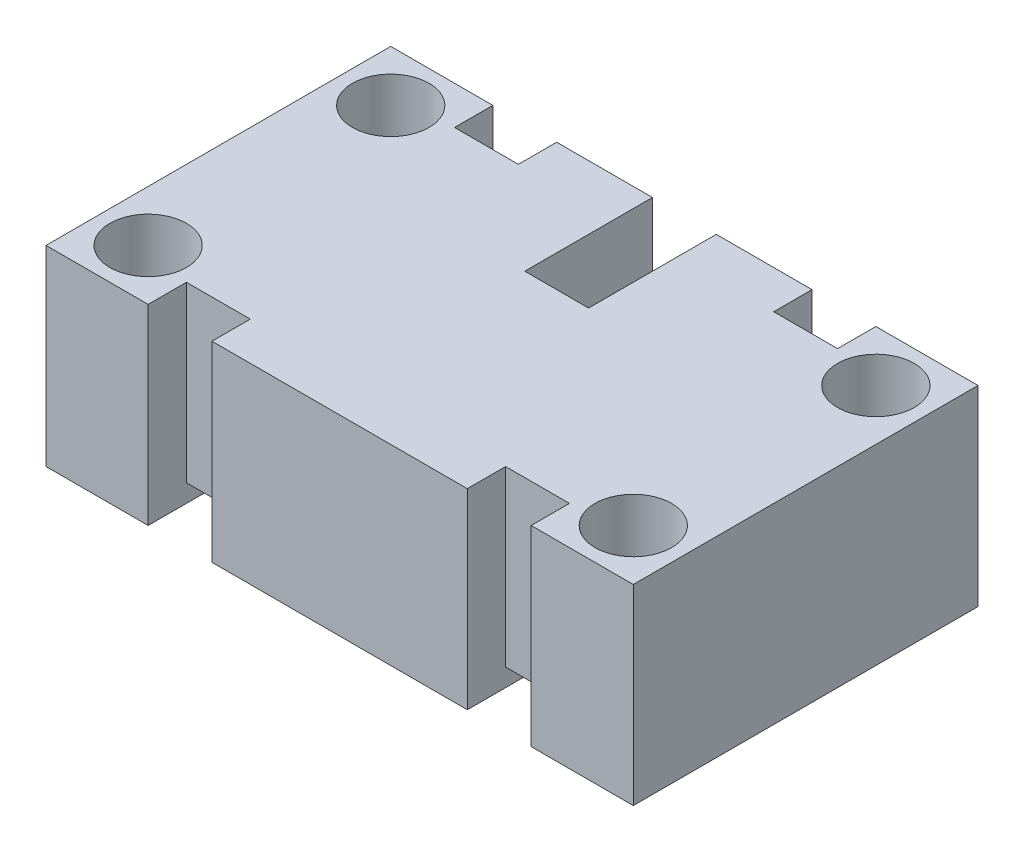
from build123d import *

# Parameters (mm, degrees)
SKETCH1_R           = 3.81
BOSS_EXTRUDE1_DEPTH = 19.05
SKETCH1_3_R         = 3.81
SKETCH1_3_R_2       = 2.159
BOSS_EXTRUDE2_DEPTH = 2.54
SKETCH2_W           = 6.35
SKETCH2_H           = 1.778
CUT_EXTRUDE2_DEPTH  = 58.700024564


with BuildPart() as part:
    # Sketch1 → Boss-Extrude1 (new body)
    with BuildSketch(Plane(origin=(0, 0, 0), x_dir=(1, 0, 0), z_dir=(0, 1, 0))):
        Polygon((-5.944680851, 17.581843972), (-16.104680851, 17.581843972), (-16.104680851, -16.708156028), (-5.944680851, -16.708156028), (-5.944680851, -12.898156028), (0.405319149, -12.898156028), (0.405319149, -16.708156028), (25.805319149, -16.708156028), (25.805319149, -12.898156028), (32.155319149, -12.898156028), (32.155319149, -16.708156028), (42.315319149, -16.708156028), (42.315319149, 17.581843972), (32.155319149, 17.581843972), (32.155319149, 13.771843972), (25.805319149, 13.771843972), (25.805319149, 17.581843972), (16.280319149, 17.581843972), (16.280319149, 4.881843972), (9.930319149, 4.881843972), (9.930319149, 17.581843972), (0.405319149, 17.581843972), (0.405319149, 13.771843972), (-5.944680851, 13.771843972), align=None)
        with Locations((-11.024680851, 12.501843972)):
            Circle(SKETCH1_R, mode=Mode.SUBTRACT)
        with Locations((37.235319149, 12.501843972)):
            Circle(SKETCH1_R, mode=Mode.SUBTRACT)
        with Locations((37.235319149, -11.628156028)):
            Circle(SKETCH1_R, mode=Mode.SUBTRACT)
        with Locations((-11.024680851, -11.628156028)):
            Circle(SKETCH1_R, mode=Mode.SUBTRACT)
    extrude(amount=BOSS_EXTRUDE1_DEPTH)

    # Sketch1<3> → Boss-Extrude2 (add)
    # profile 1 of 4: a face of its own
    with BuildSketch(Plane(origin=(0, 0, 0), x_dir=(1, 0, 0), z_dir=(0, 1, 0))):
        with Locations((-11.024680851, 12.501843972)):
            Circle(SKETCH1_3_R)
        with Locations((-11.024680851, 12.501843972)):
            Circle(SKETCH1_3_R_2, mode=Mode.SUBTRACT)
    # profile 2 of 4: a face of its own
    with BuildSketch(Plane(origin=(0, 0, 0), x_dir=(1, 0, 0), z_dir=(0, 1, 0))):
        with Locations((37.235319149, 12.501843972)):
            Circle(SKETCH1_3_R)
        with Locations((37.235319149, 12.501843972)):
            Circle(SKETCH1_3_R_2, mode=Mode.SUBTRACT)
    # profile 3 of 4: a face of its own
    with BuildSketch(Plane(origin=(0, 0, 0), x_dir=(1, 0, 0), z_dir=(0, 1, 0))):
        with Locations((-11.024680851, -11.628156028)):
            Circle(SKETCH1_3_R)
        with Locations((-11.024680851, -11.628156028)):
            Circle(SKETCH1_3_R_2, mode=Mode.SUBTRACT)
    # profile 4 of 4: a face of its own
    with BuildSketch(Plane(origin=(0, 0, 0), x_dir=(1, 0, 0), z_dir=(0, 1, 0))):
        with Locations((37.235319149, -11.628156028)):
            Circle(SKETCH1_3_R)
        with Locations((37.235319149, -11.628156028)):
            Circle(SKETCH1_3_R_2, mode=Mode.SUBTRACT)
    extrude(amount=BOSS_EXTRUDE2_DEPTH)

    # Sketch2 → Cut-Extrude2 (cut, through all)
    with BuildSketch(Plane.XY.offset(16.708156028)):
        with Locations((-2.769680851, 0.889)):
            Rectangle(SKETCH2_W, SKETCH2_H)
        with Locations((28.980319149, 0.889)):
            Rectangle(SKETCH2_W, SKETCH2_H)
    extrude(amount=-CUT_EXTRUDE2_DEPTH, mode=Mode.SUBTRACT)


solid = part.part
